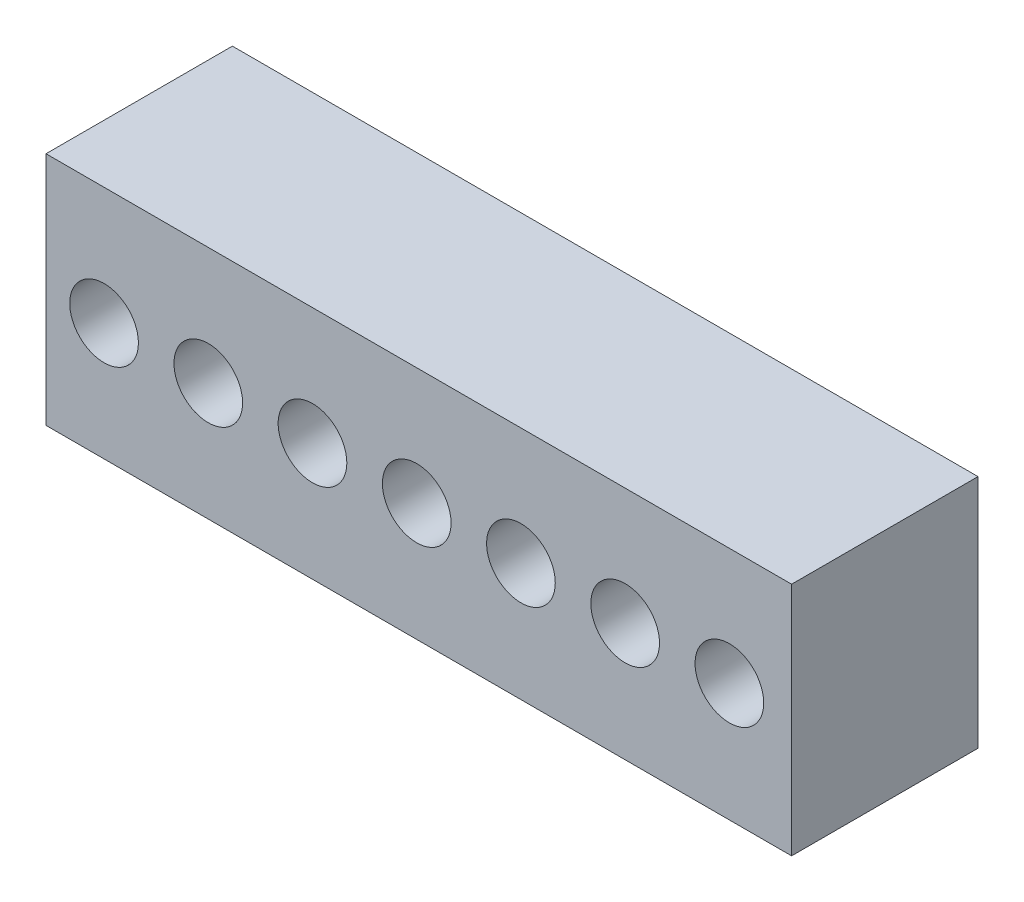
from build123d import *

# Parameters (mm, degrees)
SKETCH1_W           = 16
SKETCH1_H           = 5.049180328
SKETCH1_R           = 0.736793608
BOSS_EXTRUDE1_DEPTH = 4


with BuildPart() as part:
    # Sketch1 → Boss-Extrude1 (new body)
    with BuildSketch(Plane.XY):
        with Locations((8, 2.524590164)):
            Rectangle(SKETCH1_W, SKETCH1_H)
        with Locations((1.245901639, 2.524590164)):
            Circle(SKETCH1_R, mode=Mode.SUBTRACT)
        with Locations((3.482392233, 2.527306002)):
            Circle(SKETCH1_R, mode=Mode.SUBTRACT)
        with Locations((5.718882826, 2.53002184)):
            Circle(SKETCH1_R, mode=Mode.SUBTRACT)
        with Locations((7.955373419, 2.532737677)):
            Circle(SKETCH1_R, mode=Mode.SUBTRACT)
        with Locations((10.191864013, 2.535453515)):
            Circle(SKETCH1_R, mode=Mode.SUBTRACT)
        with Locations((12.428354606, 2.538169353)):
            Circle(SKETCH1_R, mode=Mode.SUBTRACT)
        with Locations((14.6648452, 2.540885191)):
            Circle(SKETCH1_R, mode=Mode.SUBTRACT)
    extrude(amount=BOSS_EXTRUDE1_DEPTH)


solid = part.part
